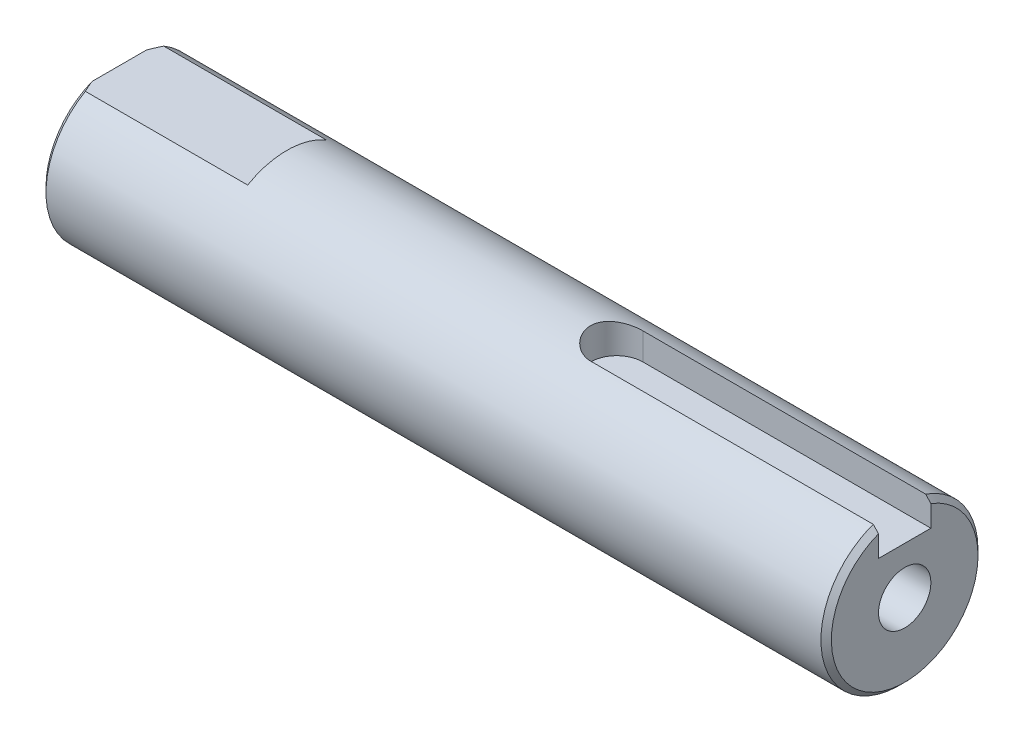
from build123d import *

# Parameters (mm, degrees)
SKETCH_2_W                     = 75
SKETCH_2_H                     = 7.5
CUT_EXTRUDE_START              = 4.5
CUT_EXTRUDE_1_DEPTH            = 72.246287038
CUT_EXTRUDE_2_DEPTH            = 76.746287157
CUT_EXTRUDE_2_DEPTH_BACK       = 76.746287157
SKETCH_4_W                     = 16
SKETCH_4_H                     = 1
M5X0_8_1_D                     = 4.2
M5X0_8_1_DEPTH                 = 14
M5X0_8_1_CBORE_D               = 5
M5X0_8_1_CBORE_DEPTH           = 10
M5X0_8_1_TIP                   = 1.2618073
M5X0_8_1_ON_FACE_2_D           = 4.2
M5X0_8_1_ON_FACE_2_DEPTH       = 14
M5X0_8_1_ON_FACE_2_CBORE_D     = 5
M5X0_8_1_ON_FACE_2_CBORE_DEPTH = 10
M5X0_8_1_ON_FACE_2_TIP         = 1.2618073
CHAMFER_1_SIZE                 = 0.5


with BuildPart() as part:
    # ｽｹｯﾁ2 → 回転1 (revolve)
    with BuildSketch(Plane.XY, mode=Mode.PRIVATE) as revolve_1_sk:
        with Locations((37.5, 3.75)):
            Rectangle(SKETCH_2_W, SKETCH_2_H)
    revolve(revolve_1_sk.sketch.rotate(Axis((0, 0, 0), (1, 0, 0)), 90), axis=Axis((0, 0, 0), (1, 0, 0)))

    # ｽｹｯﾁ3 → ｶｯﾄ - 押し出し1 (cut, through all)
    with BuildSketch(Plane(origin=(0, 0, 0), x_dir=(1, 0, 0), z_dir=(0, 1, 0)).offset(CUT_EXTRUDE_START)):
        with BuildLine():
            Line((47.5, 2.5), (75, 2.5))
            Line((75, 2.5), (75, -2.5))
            Line((75, -2.5), (47.5, -2.5))
            ThreePointArc((47.5, -2.5), (45, 0), (47.5, 2.5))
        make_face()
    extrude(amount=CUT_EXTRUDE_1_DEPTH, mode=Mode.SUBTRACT)

    # ｽｹｯﾁ4 → ｶｯﾄ - 押し出し2 (cut, two sides: drawn at the far end of the back side and taken through both)
    with BuildSketch(Plane.XY.offset(-CUT_EXTRUDE_2_DEPTH_BACK)):
        with Locations((8, 7)):
            Rectangle(SKETCH_4_W, SKETCH_4_H)
        with Locations((8, -7)):
            Rectangle(SKETCH_4_W, SKETCH_4_H)
    extrude(amount=CUT_EXTRUDE_2_DEPTH + CUT_EXTRUDE_2_DEPTH_BACK, mode=Mode.SUBTRACT)

    # M5x0.8 ねじ穴1
    with Locations(Plane(origin=(0, 0, 0), x_dir=(0, 0, -1), z_dir=(-1, 0, 0))):
        with Locations((0, 0)):
            CounterBoreHole(M5X0_8_1_D / 2, M5X0_8_1_CBORE_D / 2, M5X0_8_1_CBORE_DEPTH, depth=M5X0_8_1_DEPTH)
            with Locations((0, 0, -(M5X0_8_1_DEPTH + M5X0_8_1_TIP / 2))):  # 118° drill point
                Cone(0, M5X0_8_1_D / 2, M5X0_8_1_TIP, mode=Mode.SUBTRACT)

    # M5x0.8 ねじ穴1 on face 2
    with Locations(Plane(origin=(75, 0, 0), x_dir=(0, 0, 1), z_dir=(1, 0, 0))):
        with Locations((0, 0)):
            CounterBoreHole(M5X0_8_1_ON_FACE_2_D / 2, M5X0_8_1_ON_FACE_2_CBORE_D / 2, M5X0_8_1_ON_FACE_2_CBORE_DEPTH, depth=M5X0_8_1_ON_FACE_2_DEPTH)
            with Locations((0, 0, -(M5X0_8_1_ON_FACE_2_DEPTH + M5X0_8_1_ON_FACE_2_TIP / 2))):  # 118° drill point
                Cone(0, M5X0_8_1_ON_FACE_2_D / 2, M5X0_8_1_ON_FACE_2_TIP, mode=Mode.SUBTRACT)

    # 面取り1
    chamfer_1_edges = [part.edges().sort_by_distance(p)[0] for p in [
        (0, 0, -7.5),
        (0, -3.754168989, 6.492781777),
        (75, -6.123724357, -4.330127019),
    ]]
    chamfer(chamfer_1_edges, length=CHAMFER_1_SIZE)


solid = part.part
